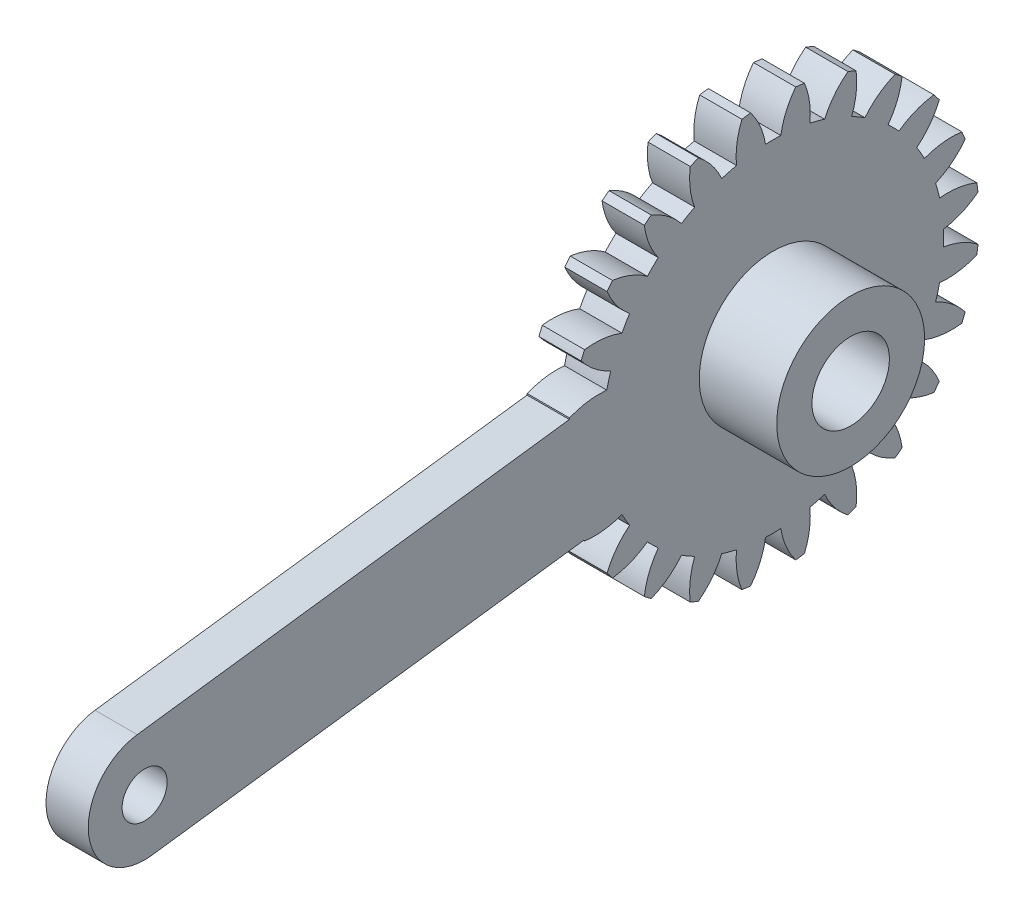
from build123d import *

# Parameters (mm, degrees)
SKETCH1_R           = 1.5
BOSS_EXTRUDE1_DEPTH = 3
SKETCH2_R           = 1.6
SKETCH2_R_2         = 1.5
BOSS_EXTRUDE2_DEPTH = 3
SKETCH3_R           = 5.25
SKETCH3_R_2         = 2.75
BOSS_EXTRUDE3_DEPTH = 5.5
CUT_EXTRUDE1_START  = -2
SKETCH4_R           = 2.75
CUT_EXTRUDE1_DEPTH  = 2


with BuildPart() as part:
    # Sketch1 → Boss-Extrude1 (new body)
    with BuildSketch(Plane(origin=(3, 0, 0), x_dir=(0, 0, -1), z_dir=(1, 0, 0))):
        with BuildLine():
            ThreePointArc((-14.537314892, 1.599093719), (-13.375367565, 0.916420874), (-12.080565177, 0.542722358))
            ThreePointArc((-12.080565177, 0.542722358), (-12.09275, 0), (-12.080565177, -0.542722358))
            ThreePointArc((-12.080565177, -0.542722358), (-13.375367565, -0.916420874), (-14.537314892, -1.599093719))
            ThreePointArc((-14.537314892, -1.599093719), (-14.499881098, -1.908945561), (-14.455843809, -2.217928037))
            ThreePointArc((-14.455843809, -2.217928037), (-13.156800143, -2.576605271), (-11.809396783, -2.602450802))
            ThreePointArc((-11.809396783, -2.602450802), (-11.680699536, -3.129834008), (-11.528463019, -3.650909885))
            ThreePointArc((-11.528463019, -3.650909885), (-12.682425791, -4.346994451), (-13.62809199, -5.30713988))
            ThreePointArc((-13.62809199, -5.30713988), (-13.511738163, -5.596745198), (-13.389230859, -5.883801663))
            ThreePointArc((-13.389230859, -5.883801663), (-12.041618533, -5.894040025), (-10.733437515, -5.57027124))
            ThreePointArc((-10.733437515, -5.57027124), (-10.472628702, -6.046375), (-10.190715157, -6.510293938))
            ThreePointArc((-10.190715157, -6.510293938), (-11.125197659, -7.48132754), (-11.79013714, -8.65351323))
            ThreePointArc((-11.79013714, -8.65351323), (-11.602792602, -8.903135899), (-11.410163953, -9.148703928))
            ThreePointArc((-11.410163953, -9.148703928), (-10.105820521, -8.809805691), (-8.926012217, -8.158486898))
            ThreePointArc((-8.926012217, -8.158486898), (-8.550865528, -8.550865528), (-8.158486898, -8.926012217))
            ThreePointArc((-8.158486898, -8.926012217), (-8.809805691, -10.105820521), (-9.148703928, -11.410163953))
            ThreePointArc((-9.148703928, -11.410163953), (-8.903135899, -11.602792602), (-8.65351323, -11.79013714))
            ThreePointArc((-8.65351323, -11.79013714), (-7.48132754, -11.125197659), (-6.510293938, -10.190715157))
            ThreePointArc((-6.510293938, -10.190715157), (-6.046375, -10.472628702), (-5.57027124, -10.733437515))
            ThreePointArc((-5.57027124, -10.733437515), (-5.894040025, -12.041618533), (-5.883801663, -13.389230859))
            ThreePointArc((-5.883801663, -13.389230859), (-5.596745198, -13.511738163), (-5.30713988, -13.62809199))
            ThreePointArc((-5.30713988, -13.62809199), (-4.346994451, -12.682425791), (-3.650909885, -11.528463019))
            ThreePointArc((-3.650909885, -11.528463019), (-3.129834008, -11.680699536), (-2.602450802, -11.809396783))
            ThreePointArc((-2.602450802, -11.809396783), (-2.576605271, -13.156800143), (-2.217928037, -14.455843809))
            ThreePointArc((-2.217928037, -14.455843809), (-1.908945561, -14.499881098), (-1.599093719, -14.537314892))
            ThreePointArc((-1.599093719, -14.537314892), (-0.916420874, -13.375367565), (-0.542722358, -12.080565177))
            ThreePointArc((-0.542722358, -12.080565177), (0, -12.09275), (0.542722358, -12.080565177))
            ThreePointArc((0.542722358, -12.080565177), (0.916420874, -13.375367565), (1.599093719, -14.537314892))
            ThreePointArc((1.599093719, -14.537314892), (1.908945561, -14.499881098), (2.217928037, -14.455843809))
            ThreePointArc((2.217928037, -14.455843809), (2.576605271, -13.156800143), (2.602450802, -11.809396783))
            ThreePointArc((2.602450802, -11.809396783), (3.129834008, -11.680699536), (3.650909885, -11.528463019))
            ThreePointArc((3.650909885, -11.528463019), (4.346994451, -12.682425791), (5.30713988, -13.62809199))
            ThreePointArc((5.30713988, -13.62809199), (5.596745198, -13.511738163), (5.883801663, -13.389230859))
            ThreePointArc((5.883801663, -13.389230859), (5.894040025, -12.041618533), (5.57027124, -10.733437515))
            ThreePointArc((5.57027124, -10.733437515), (6.046375, -10.472628702), (6.510293938, -10.190715157))
            ThreePointArc((6.510293938, -10.190715157), (7.48132754, -11.125197659), (8.65351323, -11.79013714))
            ThreePointArc((8.65351323, -11.79013714), (8.903135899, -11.602792602), (9.148703928, -11.410163953))
            ThreePointArc((9.148703928, -11.410163953), (8.809805691, -10.105820521), (8.158486898, -8.926012217))
            ThreePointArc((8.158486898, -8.926012217), (8.550865528, -8.550865528), (8.926012217, -8.158486898))
            ThreePointArc((8.926012217, -8.158486898), (10.105820521, -8.809805691), (11.410163953, -9.148703928))
            ThreePointArc((11.410163953, -9.148703928), (11.602792602, -8.903135899), (11.79013714, -8.65351323))
            ThreePointArc((11.79013714, -8.65351323), (11.125197659, -7.48132754), (10.190715157, -6.510293938))
            ThreePointArc((10.190715157, -6.510293938), (10.472628702, -6.046375), (10.733437515, -5.57027124))
            ThreePointArc((10.733437515, -5.57027124), (12.041618533, -5.894040025), (13.389230859, -5.883801663))
            ThreePointArc((13.389230859, -5.883801663), (13.511738163, -5.596745198), (13.62809199, -5.30713988))
            ThreePointArc((13.62809199, -5.30713988), (12.682425791, -4.346994451), (11.528463019, -3.650909885))
            ThreePointArc((11.528463019, -3.650909885), (11.680699536, -3.129834008), (11.809396783, -2.602450802))
            ThreePointArc((11.809396783, -2.602450802), (13.156800143, -2.576605271), (14.455843809, -2.217928037))
            ThreePointArc((14.455843809, -2.217928037), (14.499881098, -1.908945561), (14.537314892, -1.599093719))
            ThreePointArc((14.537314892, -1.599093719), (13.375367565, -0.916420874), (12.080565177, -0.542722358))
            ThreePointArc((12.080565177, -0.542722358), (12.09275, 0), (12.080565177, 0.542722358))
            ThreePointArc((12.080565177, 0.542722358), (13.375367565, 0.916420874), (14.537314892, 1.599093719))
            ThreePointArc((14.537314892, 1.599093719), (14.499881098, 1.908945561), (14.455843809, 2.217928037))
            ThreePointArc((14.455843809, 2.217928037), (13.156800143, 2.576605271), (11.809396783, 2.602450802))
            ThreePointArc((11.809396783, 2.602450802), (11.680699536, 3.129834008), (11.528463019, 3.650909885))
            ThreePointArc((11.528463019, 3.650909885), (12.682425791, 4.346994451), (13.62809199, 5.30713988))
            ThreePointArc((13.62809199, 5.30713988), (13.511738163, 5.596745198), (13.389230859, 5.883801663))
            ThreePointArc((13.389230859, 5.883801663), (12.041618533, 5.894040025), (10.733437515, 5.57027124))
            ThreePointArc((10.733437515, 5.57027124), (10.472628702, 6.046375), (10.190715157, 6.510293938))
            ThreePointArc((10.190715157, 6.510293938), (11.125197659, 7.48132754), (11.79013714, 8.65351323))
            ThreePointArc((11.79013714, 8.65351323), (11.602792602, 8.903135899), (11.410163953, 9.148703928))
            ThreePointArc((11.410163953, 9.148703928), (10.105820521, 8.809805691), (8.926012217, 8.158486898))
            ThreePointArc((8.926012217, 8.158486898), (8.550865528, 8.550865528), (8.158486898, 8.926012217))
            ThreePointArc((8.158486898, 8.926012217), (8.809805691, 10.105820521), (9.148703928, 11.410163953))
            ThreePointArc((9.148703928, 11.410163953), (8.903135899, 11.602792602), (8.65351323, 11.79013714))
            ThreePointArc((8.65351323, 11.79013714), (7.48132754, 11.125197659), (6.510293938, 10.190715157))
            ThreePointArc((6.510293938, 10.190715157), (6.046375, 10.472628702), (5.57027124, 10.733437515))
            ThreePointArc((5.57027124, 10.733437515), (5.894040025, 12.041618533), (5.883801663, 13.389230859))
            ThreePointArc((5.883801663, 13.389230859), (5.596745198, 13.511738163), (5.30713988, 13.62809199))
            ThreePointArc((5.30713988, 13.62809199), (4.346994451, 12.682425791), (3.650909885, 11.528463019))
            ThreePointArc((3.650909885, 11.528463019), (3.129834008, 11.680699536), (2.602450802, 11.809396783))
            ThreePointArc((2.602450802, 11.809396783), (2.576605271, 13.156800143), (2.217928037, 14.455843809))
            ThreePointArc((2.217928037, 14.455843809), (1.908945561, 14.499881098), (1.599093719, 14.537314892))
            ThreePointArc((1.599093719, 14.537314892), (0.916420874, 13.375367565), (0.542722358, 12.080565177))
            ThreePointArc((0.542722358, 12.080565177), (0, 12.09275), (-0.542722358, 12.080565177))
            ThreePointArc((-0.542722358, 12.080565177), (-0.916420874, 13.375367565), (-1.599093719, 14.537314892))
            ThreePointArc((-1.599093719, 14.537314892), (-1.908945561, 14.499881098), (-2.217928037, 14.455843809))
            ThreePointArc((-2.217928037, 14.455843809), (-2.576605271, 13.156800143), (-2.602450802, 11.809396783))
            ThreePointArc((-2.602450802, 11.809396783), (-3.129834008, 11.680699536), (-3.650909885, 11.528463019))
            ThreePointArc((-3.650909885, 11.528463019), (-4.346994451, 12.682425791), (-5.30713988, 13.62809199))
            ThreePointArc((-5.30713988, 13.62809199), (-5.596745198, 13.511738163), (-5.883801663, 13.389230859))
            ThreePointArc((-5.883801663, 13.389230859), (-5.894040025, 12.041618533), (-5.57027124, 10.733437515))
            ThreePointArc((-5.57027124, 10.733437515), (-6.046375, 10.472628702), (-6.510293938, 10.190715157))
            ThreePointArc((-6.510293938, 10.190715157), (-7.48132754, 11.125197659), (-8.65351323, 11.79013714))
            ThreePointArc((-8.65351323, 11.79013714), (-8.903135899, 11.602792602), (-9.148703928, 11.410163953))
            ThreePointArc((-9.148703928, 11.410163953), (-8.809805691, 10.105820521), (-8.158486898, 8.926012217))
            ThreePointArc((-8.158486898, 8.926012217), (-8.550865528, 8.550865528), (-8.926012217, 8.158486898))
            ThreePointArc((-8.926012217, 8.158486898), (-10.105820521, 8.809805691), (-11.410163953, 9.148703928))
            ThreePointArc((-11.410163953, 9.148703928), (-11.602792602, 8.903135899), (-11.79013714, 8.65351323))
            ThreePointArc((-11.79013714, 8.65351323), (-11.125197659, 7.48132754), (-10.190715157, 6.510293938))
            ThreePointArc((-10.190715157, 6.510293938), (-10.472628702, 6.046375), (-10.733437515, 5.57027124))
            ThreePointArc((-10.733437515, 5.57027124), (-12.041618533, 5.894040025), (-13.389230859, 5.883801663))
            ThreePointArc((-13.389230859, 5.883801663), (-13.511738163, 5.596745198), (-13.62809199, 5.30713988))
            ThreePointArc((-13.62809199, 5.30713988), (-12.682425791, 4.346994451), (-11.528463019, 3.650909885))
            ThreePointArc((-11.528463019, 3.650909885), (-11.680699536, 3.129834008), (-11.809396783, 2.602450802))
            ThreePointArc((-11.809396783, 2.602450802), (-13.156800143, 2.576605271), (-14.455843809, 2.217928037))
            ThreePointArc((-14.455843809, 2.217928037), (-14.499881098, 1.908945561), (-14.537314892, 1.599093719))
        make_face()
        with Locations(Location((0, 0, 0), (0, 0, 180))):
            Circle(SKETCH1_R, mode=Mode.SUBTRACT)
    extrude(amount=-BOSS_EXTRUDE1_DEPTH)

    # Sketch2 → Boss-Extrude2 (add)
    with BuildSketch(Plane(origin=(3, 0, 0), x_dir=(0, 0, -1), z_dir=(1, 0, 0))):
        with BuildLine():
            Line((0.522104769, -3.965779445), (-44.092913993, -9.839458095))
            ThreePointArc((-44.092913993, -9.839458095), (-48.580798207, -6.395783419), (-45.137123531, -1.907899204))
            Line((-45.137123531, -1.907899204), (-0.522104769, 3.965779445))
            ThreePointArc((-0.522104769, 3.965779445), (3.965779445, 0.522104769), (0.522104769, -3.965779445))
        make_face()
        with Locations((-44.615018762, -5.87367865)):
            Circle(SKETCH2_R, mode=Mode.SUBTRACT)
        with Locations(Location((0, 0, 0), (0, 0, 180))):
            Circle(SKETCH2_R_2, mode=Mode.SUBTRACT)
    extrude(amount=-BOSS_EXTRUDE2_DEPTH)

    # Sketch3 → Boss-Extrude3 (add)
    with BuildSketch(Plane(origin=(3, 0, 0), x_dir=(0, 0, -1), z_dir=(1, 0, 0))):
        Circle(SKETCH3_R)
        Circle(SKETCH3_R_2, mode=Mode.SUBTRACT)
    extrude(amount=BOSS_EXTRUDE3_DEPTH)

    # Sketch4 → Cut-Extrude1 (cut)
    with BuildSketch(Plane(origin=(3, 0, 0), x_dir=(0, 0, -1), z_dir=(1, 0, 0)).offset(CUT_EXTRUDE1_START)):
        Circle(SKETCH4_R)
    extrude(amount=CUT_EXTRUDE1_DEPTH, mode=Mode.SUBTRACT)


solid = part.part
